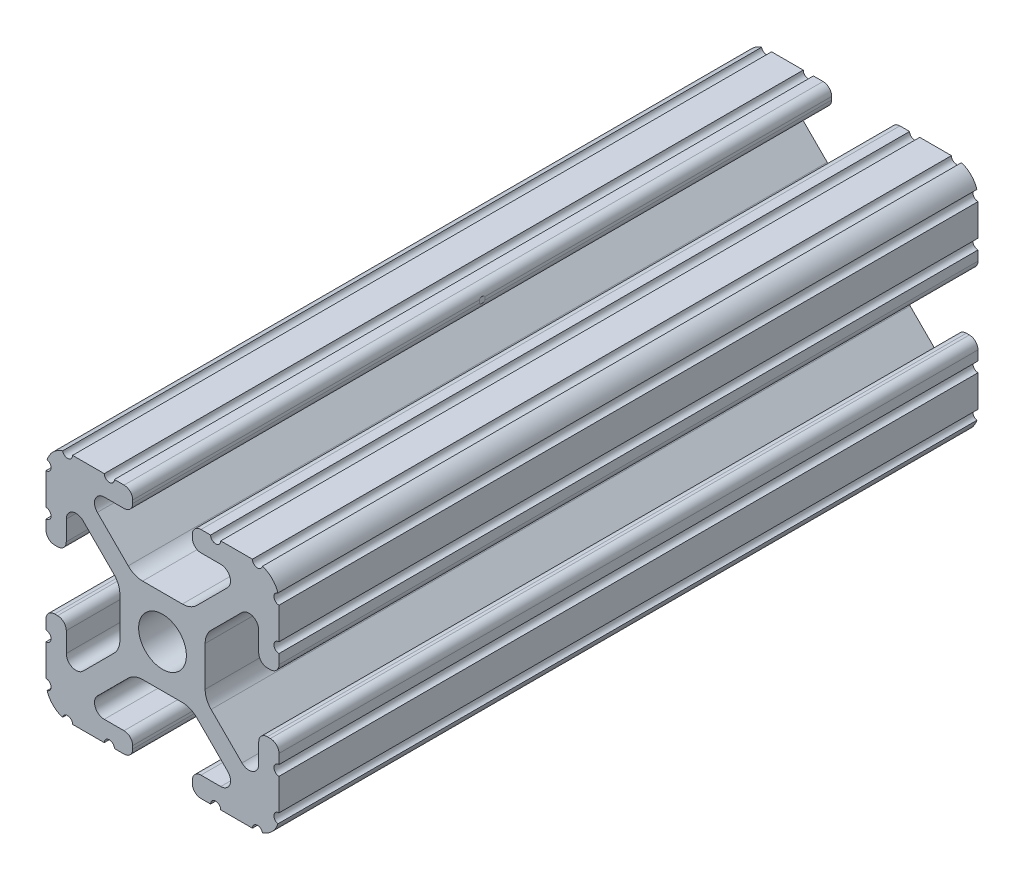
from build123d import *

# Parameters (mm, degrees)
BOSS_EXTRUDE1_DEPTH     = 76.2
CUT_EXTRUDE1_DEPTH      = 79.288057838
CUT_EXTRUDE1_DEPTH_BACK = 79.288057838
SKETCH5_R               = 0.55245
SKETCH6_W               = 25.4
SKETCH6_H               = 25.4
CUT_EXTRUDE4_DEPTH      = 79.288057838
SKETCH8_R               = 3.2639
CUT_EXTRUDE6_DEPTH      = 82.319677815


with BuildPart() as part:
    # Sketch4 → Boss-Extrude1 (new, symmetric)
    with BuildSketch(Plane.XY):
        with BuildLine():
            Line((4.190365, -12.7), (10.11729625, -12.7))
            ThreePointArc((10.11729625, -12.7), (11.943543585, -11.943543585), (12.7, -10.11729625))
            Line((12.7, -10.11729625), (12.7, -4.190365))
            ThreePointArc((12.7, -4.190365), (12.42492494, -3.52627506), (11.760835, -3.2512))
            Line((11.760835, -3.2512), (11.429365, -3.2512))
            ThreePointArc((11.429365, -3.2512), (10.76527506, -3.52627506), (10.4902, -4.190365))
            Line((10.4902, -4.190365), (10.4902, -6.348478019))
            ThreePointArc((10.4902, -6.348478019), (9.830707141, -7.335478831), (8.666460301, -7.103895736))
            Line((8.666460301, -7.103895736), (5.299899128, -3.737334563))
            ThreePointArc((5.299899128, -3.737334563), (4.817571085, -3.015479634), (4.6482, -2.16399369))
            Line((4.6482, -2.16399369), (4.6482, 0))
            Line((4.6482, 0), (2.6035, 0))
            ThreePointArc((2.6035, 0), (1.840952505, -1.840952505), (0, -2.6035))
            Line((0, -2.6035), (0, -4.6482))
            Line((0, -4.6482), (2.16399369, -4.6482))
            ThreePointArc((2.16399369, -4.6482), (3.015479634, -4.817571085), (3.737334563, -5.299899128))
            Line((3.737334563, -5.299899128), (7.103895736, -8.666460301))
            ThreePointArc((7.103895736, -8.666460301), (7.335478831, -9.830707141), (6.348478019, -10.4902))
            Line((6.348478019, -10.4902), (4.190365, -10.4902))
            ThreePointArc((4.190365, -10.4902), (3.52627506, -10.76527506), (3.2512, -11.429365))
            Line((3.2512, -11.429365), (3.2512, -11.760835))
            ThreePointArc((3.2512, -11.760835), (3.52627506, -12.42492494), (4.190365, -12.7))
        make_face()
    extrude(amount=BOSS_EXTRUDE1_DEPTH, both=True)

    # Sketch5 → Cut-Extrude1 (cut, two sides: drawn at the far end of the back side and taken through both)
    with BuildSketch(Plane.XY.offset(-CUT_EXTRUDE1_DEPTH_BACK)):
        with Locations((10.356153152, -12.7)):
            Circle(SKETCH5_R)
        with Locations((5.796028019, -12.7)):
            Circle(SKETCH5_R)
        with Locations((12.7, -10.356153152)):
            Circle(SKETCH5_R)
        with Locations((12.7, -5.796028019)):
            Circle(SKETCH5_R)
    extrude(amount=CUT_EXTRUDE1_DEPTH + CUT_EXTRUDE1_DEPTH_BACK, mode=Mode.SUBTRACT)

    # Mirror1: part across plane


with BuildPart() as part_1:
    add(part.part)
    add(part.part.mirror(Plane(origin=(0, 0, 0), x_dir=(0, 0, 1), z_dir=(1, 0, 0))))

    # Mirror2: part across plane


with BuildPart() as part_2:
    add(part_1.part)
    add(part_1.part.mirror(Plane.ZX))

    # Sketch6 → Cut-Extrude4 (cut, through all)
    with BuildSketch(Plane(origin=(0, 0, 0), x_dir=(-1, 0, 0), z_dir=(0, 0, -1))):
        Rectangle(SKETCH6_W, SKETCH6_H)
    extrude(amount=-CUT_EXTRUDE4_DEPTH, mode=Mode.SUBTRACT)

    # Sketch8 → Cut-Extrude6 (cut, through all)
    with BuildSketch(Plane(origin=(0, 12.7, 0), x_dir=(1, 0, 0), z_dir=(0, 1, 0))):
        with Locations(Location((0, 38.1, 0), (0, 0, 311.529729521))):
            Circle(SKETCH8_R)
    extrude(amount=-CUT_EXTRUDE6_DEPTH, mode=Mode.SUBTRACT)


solid = part_2.part
